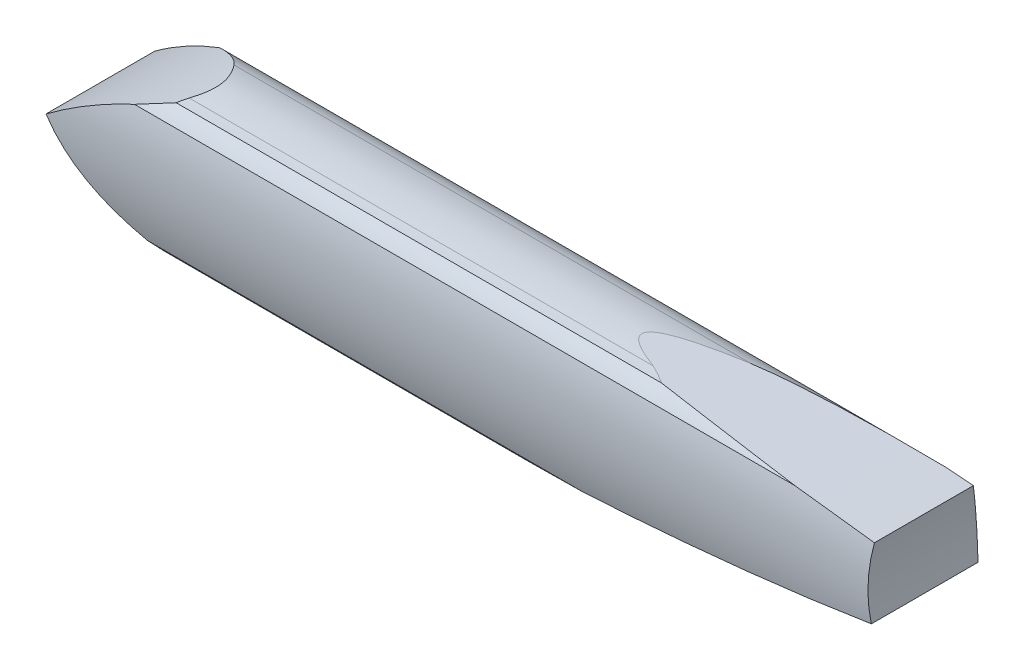
from build123d import *

# Parameters (mm, degrees)
BOSS_EXTRUDE1_DEPTH     = 100
CUT_EXTRUDE3_DEPTH      = 550.891405391
CUT_EXTRUDE3_DEPTH_BACK = 550.891405391
CUT_EXTRUDE5_DEPTH      = 550.686535404
CUT_EXTRUDE5_DEPTH_BACK = 550.686535404


with BuildPart() as part:
    # Sketch1 → Boss-Extrude1 (new body)
    with BuildSketch(Plane.XY):
        with BuildLine():
            ThreePointArc((-192.629438793, 0), (-136.135725272, 33.719619965), (-73.991525193, 55.321722514))
            ThreePointArc((-73.991525193, 55.321722514), (231.264395529, 54.89097703), (535.785554592, 33.719619965))
            ThreePointArc((535.785554592, 33.719619965), (534.174229279, 3.332708678), (535.785554592, -27.054202608))
            ThreePointArc((535.785554592, -27.054202608), (235.762691459, -64.934671976), (-66.568309368, -71.614065728))
            ThreePointArc((-66.568309368, -71.614065728), (-137.800866021, -50.244872094), (-192.629438793, 0))
        make_face()
    extrude(amount=BOSS_EXTRUDE1_DEPTH)

    # Sketch2 → Cut-Extrude3 (cut, two sides: drawn at the far end of the back side and taken through both)
    with BuildSketch(Plane(origin=(0, 0, 0), x_dir=(0, 0, -1), z_dir=(1, 0, 0)).offset(-CUT_EXTRUDE3_DEPTH_BACK)):
        with BuildLine():
            ThreePointArc((-65.447202994, 54.830423707), (-80.892507985, 50.983746932), (-92.956496986, 40.600368972))
            ThreePointArc((-92.956496986, 40.600368972), (-98.736407831, -10.977338679), (-88.967303886, -61.950193259))
            ThreePointArc((-88.967303886, -61.950193259), (-83.10915251, -68.165990231), (-75.589128758, -72.216090516))
            ThreePointArc((-75.589128758, -72.216090516), (-123.822815089, -94.064788666), (-173.378544397, -75.407784602))
            ThreePointArc((-173.378544397, -75.407784602), (-163.802190068, -4.583325871), (-135.262897635, 60.940099743))
            ThreePointArc((-135.262897635, 60.940099743), (-100.366866686, 80.430667917), (-61.326949176, 89.003885783))
            ThreePointArc((-61.326949176, 89.003885783), (-63.560434952, 71.938056418), (-65.447202994, 54.830423707))
        make_face()
    extrude(amount=CUT_EXTRUDE3_DEPTH + CUT_EXTRUDE3_DEPTH_BACK, mode=Mode.SUBTRACT)

    # Sketch3 → Cut-Extrude5 (cut, two sides: drawn at the far end of the back side and taken through both)
    with BuildSketch(Plane(origin=(0, 0, 0), x_dir=(0, 0, -1), z_dir=(1, 0, 0)).offset(-CUT_EXTRUDE5_DEPTH_BACK)):
        with BuildLine():
            ThreePointArc((-74.208303325, 50.886642831), (-50.335012976, 52.211638999), (-26.713093985, 48.511024166))
            ThreePointArc((-26.713093985, 48.511024166), (-16.247111553, 43.841102683), (-7.714956491, 36.189482926))
            ThreePointArc((-7.714956491, 36.189482926), (-2.445034952, -12.786836037), (-8.678058045, -61.649923489))
            ThreePointArc((-8.678058045, -61.649923489), (-17.453523943, -70.69509128), (-29.511303704, -74.360307413))
            ThreePointArc((-29.511303704, -74.360307413), (33.955140221, -79.826327987), (85.286434054, -42.104117568))
            ThreePointArc((85.286434054, -42.104117568), (41.180066923, 16.064388488), (12.319514625, 83.116720583))
            ThreePointArc((12.319514625, 83.116720583), (-170.558095104, 441.821406771), (-74.208303325, 50.886642831))
        make_face()
    extrude(amount=CUT_EXTRUDE5_DEPTH + CUT_EXTRUDE5_DEPTH_BACK, mode=Mode.SUBTRACT)


solid = part.part
